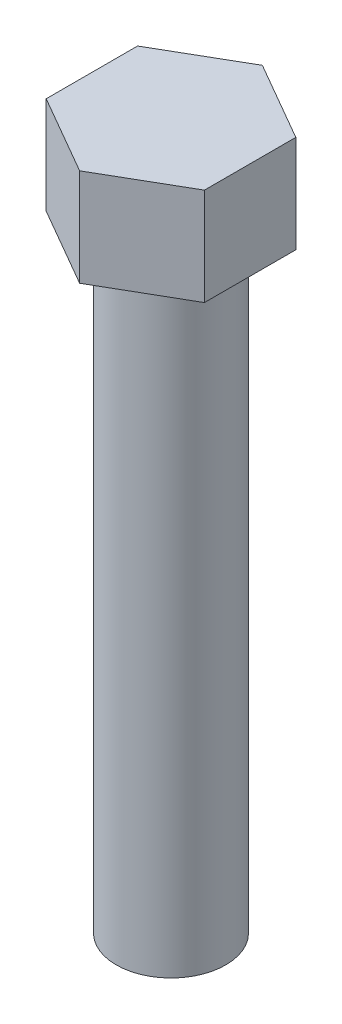
from build123d import *

# Parameters (mm, degrees)
SKETCH1_R           = 2.25
BOSS_EXTRUDE1_DEPTH = 25
BOSS_EXTRUDE2_DEPTH = 4


with BuildPart() as part:
    # Sketch1 → Boss-Extrude1 (new body)
    with BuildSketch(Plane(origin=(0, 0, 0), x_dir=(1, 0, 0), z_dir=(0, 1, 0))):
        with Locations(Location((0, 0, 0), (0, 0, 270))):
            Circle(SKETCH1_R)
    extrude(amount=BOSS_EXTRUDE1_DEPTH)

    # Sketch2 → Boss-Extrude2 (add)
    with BuildSketch(Plane(origin=(0, 25, 0), x_dir=(1, 0, 0), z_dir=(0, 1, 0))):
        Polygon((3.25, -1.876388375), (3.25, 1.876388375), (0, 3.75277675), (-3.25, 1.876388375), (-3.25, -1.876388375), (0, -3.75277675), align=None)
    extrude(amount=BOSS_EXTRUDE2_DEPTH)


solid = part.part
